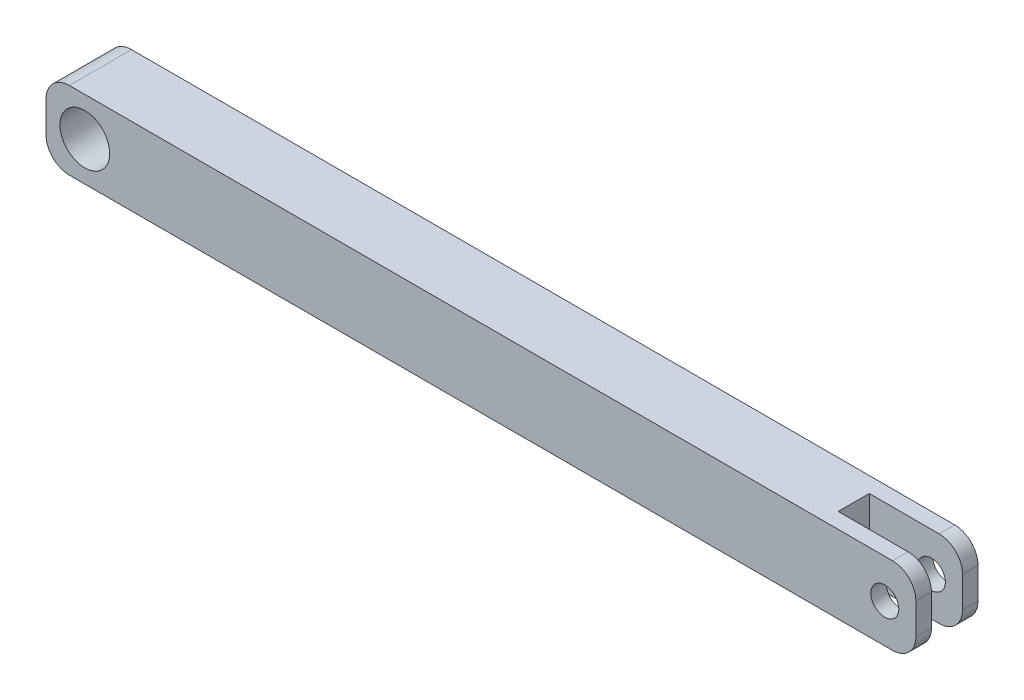
from build123d import *

# Parameters (mm, degrees)
SKETCH_5_W          = 56
SKETCH_5_H          = 3
EXTRUDE_1_DEPTH     = 5
CUT_EXTRUDE_1_REACH = 58.303
SKETCH_6_R          = 1.6
CUT_EXTRUDE_2_REACH = 58.303
SKETCH_7_R          = 0.9
FILLET_1_R          = 1.5
SKETCH_8_W          = 6
SKETCH_8_H          = 1.6
CUT_EXTRUDE_3_DEPTH = 10
SKETCH_10_R         = 1.6
SKETCH_10_R_2       = 0.9
EXTRUDE_2_DEPTH     = 0.5
EXTRUDE_START       = 0.5
SKETCH_11_R         = 0.9
SKETCH_11_R_2       = 1.6
EXTRUDE_3_DEPTH     = 0.5
SKETCH_12_W         = 6.842300405
SKETCH_12_H         = 2
CUT_EXTRUDE_4_DEPTH = 10


with BuildPart() as part:
    # 草图5 → 凸台-拉伸1 (new body)
    with BuildSketch(Plane(origin=(0, 0, 0), x_dir=(1, 0, 0), z_dir=(0, 1, 0))):
        with Locations((28, -1.5)):
            Rectangle(SKETCH_5_W, SKETCH_5_H)
    extrude(amount=EXTRUDE_1_DEPTH)

    # 草图6 → 切除-拉伸1 (cut, up to next)
    with BuildSketch(Plane.XY.offset(3), mode=Mode.PRIVATE) as cut_extrude_1_sk1:
        with Locations((2.5, 2.5)):
            Circle(SKETCH_6_R)
    cut_extrude_1_tool1 = extrude(cut_extrude_1_sk1.sketch, amount=-CUT_EXTRUDE_1_REACH, mode=Mode.PRIVATE) & part.part
    add(cut_extrude_1_tool1.solids().sort_by_distance((2.5, 2.5, 3))[0], mode=Mode.SUBTRACT)

    # 草图7 → 切除-拉伸2 (cut, up to next)
    with BuildSketch(Plane.XY, mode=Mode.PRIVATE) as cut_extrude_2_sk1:
        with Locations(Location((54, 2.5, 0), (0, 0, 180))):
            Circle(SKETCH_7_R)
    cut_extrude_2_tool1 = extrude(cut_extrude_2_sk1.sketch, amount=CUT_EXTRUDE_2_REACH, mode=Mode.PRIVATE) & part.part
    add(cut_extrude_2_tool1.solids().sort_by_distance((54, 2.5, 0))[0], mode=Mode.SUBTRACT)

    # 圆角1
    fillet_1_edges = [part.edges().sort_by_distance(p)[0] for p in [
        (56, 5, 1.5),
        (56, 0, 1.5),
        (0, 0, 1.5),
        (0, 5, 1.5),
    ]]
    fillet(fillet_1_edges, radius=FILLET_1_R)

    # 草图8 → 切除-拉伸3 (cut)
    with BuildSketch(Plane(origin=(0, 5, 0), x_dir=(1, 0, 0), z_dir=(0, 1, 0))):
        with Locations((53, -1.5)):
            Rectangle(SKETCH_8_W, SKETCH_8_H)
    extrude(amount=-CUT_EXTRUDE_3_DEPTH, mode=Mode.SUBTRACT)

    # 草图10 → 凸台-拉伸2 (add)
    with BuildSketch(Plane.XY.offset(3)):
        with BuildLine():
            Line((56, 1.5), (56, 3.5))
            ThreePointArc((56, 3.5), (55.560660172, 4.560660172), (54.5, 5))
            Line((54.5, 5), (1.5, 5))
            ThreePointArc((1.5, 5), (0.439339828, 4.560660172), (0, 3.5))
            Line((0, 3.5), (0, 1.5))
            ThreePointArc((0, 1.5), (0.439339828, 0.439339828), (1.5, 0))
            Line((1.5, 0), (54.5, 0))
            ThreePointArc((54.5, 0), (55.560660172, 0.439339828), (56, 1.5))
        make_face()
        with Locations((2.5, 2.5)):
            Circle(SKETCH_10_R, mode=Mode.SUBTRACT)
        with Locations(Location((54, 2.5, 0), (0, 0, 180))):
            Circle(SKETCH_10_R_2, mode=Mode.SUBTRACT)
    extrude(amount=EXTRUDE_2_DEPTH)

    # 草图11 → 凸台-拉伸3 (add)
    with BuildSketch(Plane(origin=(0, 0, 0), x_dir=(-1, 0, 0), z_dir=(0, 0, -1)).offset(EXTRUDE_START)):
        with BuildLine():
            Line((-1.5, 5), (-54.5, 5))
            ThreePointArc((-54.5, 5), (-55.560660172, 4.560660172), (-56, 3.5))
            Line((-56, 3.5), (-56, 1.5))
            ThreePointArc((-56, 1.5), (-55.560660172, 0.439339828), (-54.5, 0))
            Line((-54.5, 0), (-1.5, 0))
            ThreePointArc((-1.5, 0), (-0.439339828, 0.439339828), (0, 1.5))
            Line((0, 1.5), (0, 3.5))
            ThreePointArc((0, 3.5), (-0.439339828, 4.560660172), (-1.5, 5))
        make_face()
        with Locations((-54, 2.5)):
            Circle(SKETCH_11_R, mode=Mode.SUBTRACT)
        with Locations(Location((-2.5, 2.5, 0), (0, 0, 180))):
            Circle(SKETCH_11_R_2, mode=Mode.SUBTRACT)
    extrude(amount=-EXTRUDE_3_DEPTH)

    # 草图12 → 切除-拉伸4 (cut)
    with BuildSketch(Plane(origin=(0, 5, 0), x_dir=(1, 0, 0), z_dir=(0, 1, 0))):
        with Locations((53.421150203, -1.5)):
            Rectangle(SKETCH_12_W, SKETCH_12_H)
    extrude(amount=-CUT_EXTRUDE_4_DEPTH, mode=Mode.SUBTRACT)


solid = part.part
